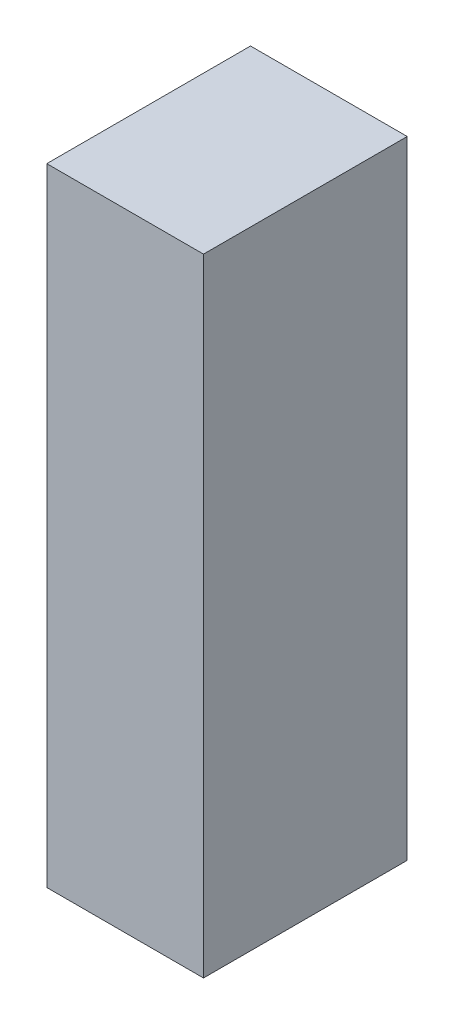
from build123d import *

# Parameters (mm, degrees)
SKETCH1_W           = 5
SKETCH1_H           = 6.5
BOSS_EXTRUDE1_DEPTH = 20


with BuildPart() as part:
    # Sketch1 → Boss-Extrude1 (new body)
    with BuildSketch(Plane(origin=(0, 0, 0), x_dir=(1, 0, 0), z_dir=(0, 1, 0))):
        Rectangle(SKETCH1_W, SKETCH1_H)
    extrude(amount=BOSS_EXTRUDE1_DEPTH)


solid = part.part
